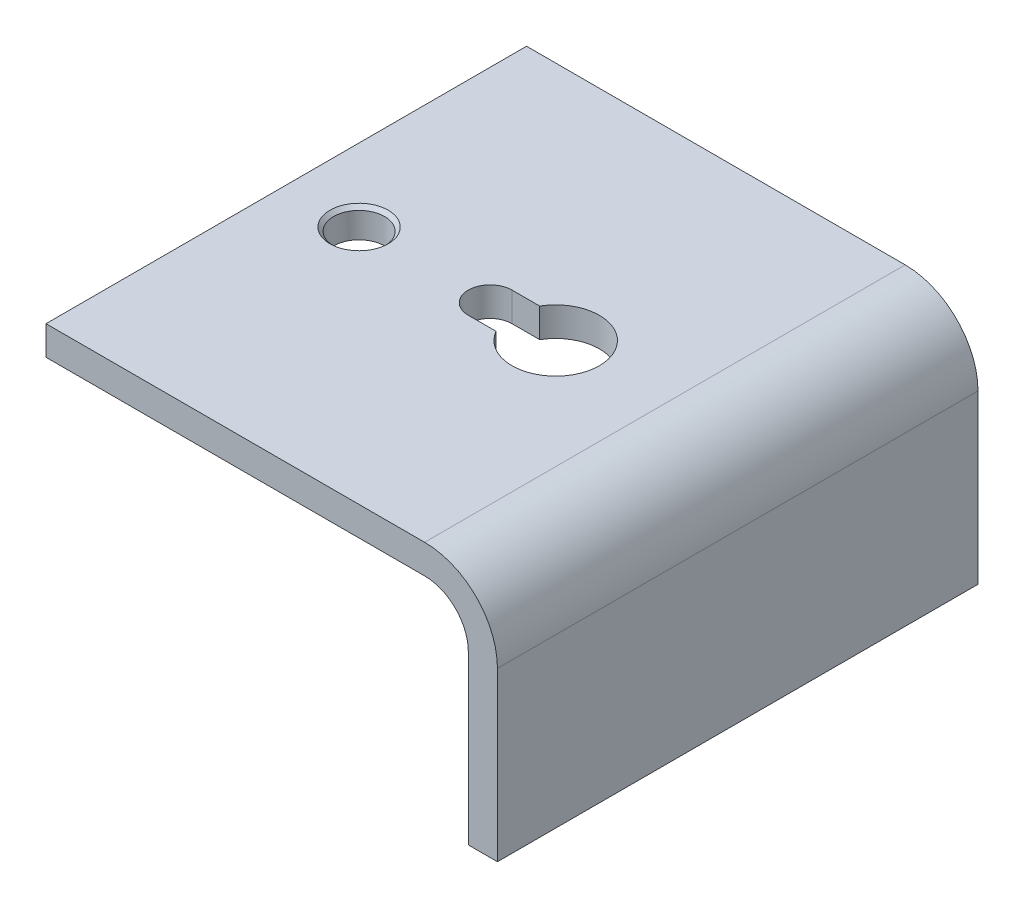
from build123d import *

# Parameters (mm, degrees)
BOSS_EXTRUDE1_DEPTH = 66
CUT_EXTRUDE2_DEPTH  = 10
SKETCH3_R           = 3.5
CUT_EXTRUDE3_DEPTH  = 10
CHAMFER1_SIZE       = 0.5


with BuildPart() as part:
    # Sketch1 → Boss-Extrude1 (new body)
    with BuildSketch(Plane.XY):
        with BuildLine():
            Line((0, 29), (52, 29))
            ThreePointArc((52, 29), (56.242640687, 27.242640687), (58, 23))
            Line((58, 23), (58, 0))
            Line((58, 0), (62, 0))
            Line((62, 0), (62, 23))
            ThreePointArc((62, 23), (59.071067812, 30.071067812), (52, 33))
            Line((52, 33), (0, 33))
            Line((0, 33), (0, 29))
        make_face()
    extrude(amount=BOSS_EXTRUDE1_DEPTH)

    # Sketch2 → Cut-Extrude2 (cut)
    with BuildSketch(Plane(origin=(0, 33, 0), x_dir=(1, 0, 0), z_dir=(0, 1, 0))):
        with BuildLine():
            Line((28, -30), (31.803847577, -30))
            ThreePointArc((31.803847577, -30), (43, -33), (31.803847577, -36))
            Line((31.803847577, -36), (28, -36))
            ThreePointArc((28, -36), (25, -33), (28, -30))
        make_face()
    extrude(amount=-CUT_EXTRUDE2_DEPTH, mode=Mode.SUBTRACT)

    # Sketch3 → Cut-Extrude3 (cut)
    with BuildSketch(Plane(origin=(0, 33, 0), x_dir=(1, 0, 0), z_dir=(0, 1, 0))):
        with Locations(Location((10, -33, 0), (0, 0, 270))):
            Circle(SKETCH3_R)
    extrude(amount=-CUT_EXTRUDE3_DEPTH, mode=Mode.SUBTRACT)

    # Chamfer1
    chamfer1_edges = [part.edges().sort_by_distance(p)[0] for p in [
        (10, 33, 29.5),
    ]]
    chamfer(chamfer1_edges, length=CHAMFER1_SIZE)


solid = part.part
